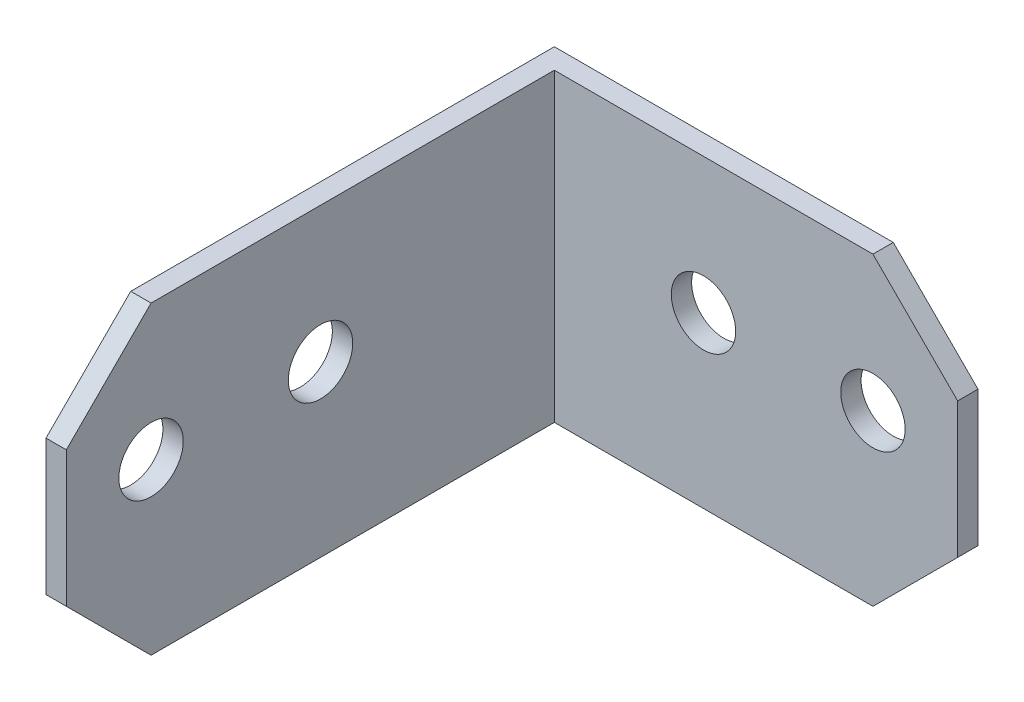
from build123d import *

# Parameters (mm, degrees)
BOSS_EXTRUDE1_DEPTH = 22.86
SKETCH2_R           = 2.413
CUT_EXTRUDE1_DEPTH  = 54.73826082
SKETCH3_R           = 2.413
CUT_EXTRUDE2_DEPTH  = 54.55787408
CHAMFER1_SIZE       = 6.35


with BuildPart() as part:
    # Sketch1 → Boss-Extrude1 (new body)
    with BuildSketch(Plane(origin=(0, 0, 0), x_dir=(1, 0, 0), z_dir=(0, 1, 0))):
        Polygon((0, 0), (0, 38.1), (31.75, 38.1), (31.75, 36.576), (1.524, 36.576), (1.524, 0), align=None)
    extrude(amount=BOSS_EXTRUDE1_DEPTH)

    # Sketch2 → Cut-Extrude1 (cut, through all)
    with BuildSketch(Plane(origin=(1.524, 0, 0), x_dir=(0, 0, -1), z_dir=(1, 0, 0))):
        with Locations((6.35, 12.7)):
            Circle(SKETCH2_R)
        with Locations((19.05, 12.7)):
            Circle(SKETCH2_R)
    extrude(amount=-CUT_EXTRUDE1_DEPTH, mode=Mode.SUBTRACT)

    # Sketch3 → Cut-Extrude2 (cut, through all)
    with BuildSketch(Plane.XY.offset(-36.576)):
        with Locations((25.4, 12.7)):
            Circle(SKETCH3_R)
        with Locations((12.7, 12.7)):
            Circle(SKETCH3_R)
    extrude(amount=-CUT_EXTRUDE2_DEPTH, mode=Mode.SUBTRACT)

    # Chamfer1
    chamfer1_edges = [part.edges().sort_by_distance(p)[0] for p in [
        (31.75, 22.86, -37.338),
        (0.762, 22.86, 0),
        (31.75, 0, -37.338),
        (0.762, 0, 0),
    ]]
    chamfer(chamfer1_edges, length=CHAMFER1_SIZE)


solid = part.part
